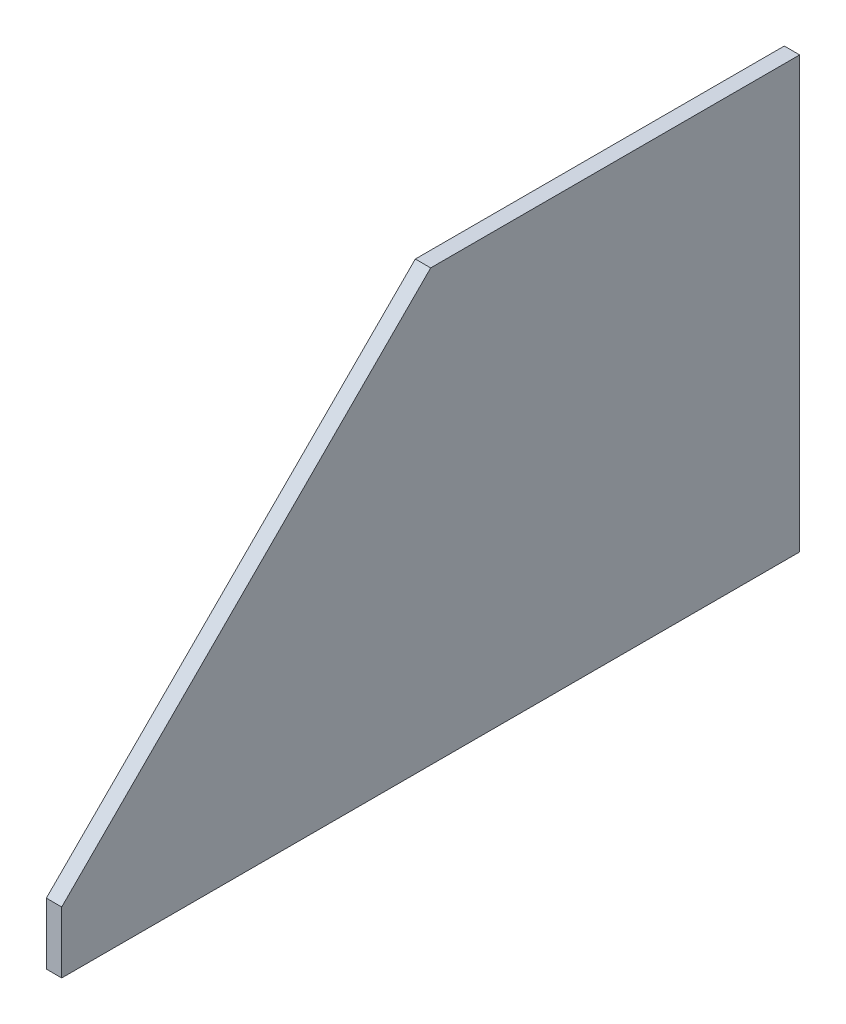
from build123d import *

# Parameters (mm, degrees)
ESQUISSE2_W        = 304.8
ESQUISSE2_H        = 25.4
BOSS_EXTRU_1_DEPTH = 6.35


with BuildPart() as part:
    # Esquisse2 → Boss.-Extru.1 (new body)
    with BuildSketch(Plane(origin=(0, 0, 0), x_dir=(0, 0, -1), z_dir=(1, 0, 0))):
        Polygon((0, 152.4), (0, 0), (-304.8, 0), (-152.4, 152.4), align=None)
        with Locations((-152.4, -12.7)):
            Rectangle(ESQUISSE2_W, ESQUISSE2_H)
    extrude(amount=BOSS_EXTRU_1_DEPTH)


solid = part.part
